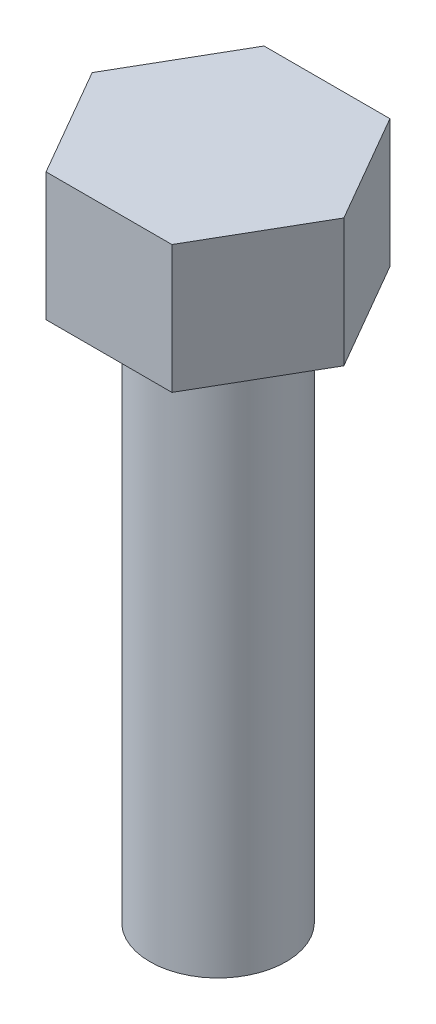
from build123d import *

# Parameters (mm, degrees)
HEAD_DEPTH = 4.7
SKBODY_R   = 2.5
BODY_DEPTH = 20


with BuildPart() as part:
    # skHead → Head (new body)
    with BuildSketch(Plane(origin=(0, 0, 0), x_dir=(1, 0, 0), z_dir=(0, 1, 0))):
        Polygon((4.618802154, 0), (2.309401077, 4), (-2.309401077, 4), (-4.618802154, 0), (-2.309401077, -4), (2.309401077, -4), align=None)
    extrude(amount=HEAD_DEPTH)

    # skBody → Body (add)
    with BuildSketch(Plane(origin=(0, 0, 0), x_dir=(1, 0, 0), z_dir=(0, 1, 0))):
        Circle(SKBODY_R)
    extrude(amount=-BODY_DEPTH)


solid = part.part
